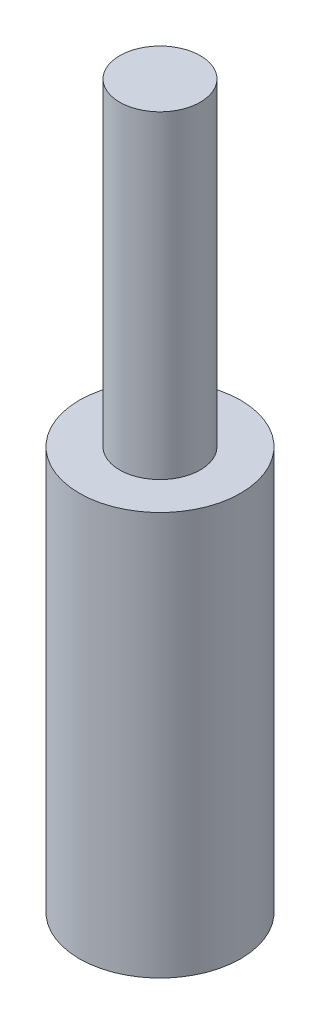
from build123d import *

# Parameters (mm, degrees)
SKETCH1_R           = 2
BOSS_EXTRUDE1_DEPTH = 10
SKETCH2_R           = 1
BOSS_EXTRUDE2_DEPTH = 7.9


with BuildPart() as part:
    # Sketch1 → Boss-Extrude1 (new body)
    with BuildSketch(Plane(origin=(0, 0, 0), x_dir=(1, 0, 0), z_dir=(0, 1, 0))):
        with Locations(Location((0, 0, 0), (0, 0, 270))):
            Circle(SKETCH1_R)
    extrude(amount=BOSS_EXTRUDE1_DEPTH)

    # Sketch2 → Boss-Extrude2 (add)
    with BuildSketch(Plane(origin=(0, 10, 0), x_dir=(1, 0, 0), z_dir=(0, 1, 0))):
        with Locations(Location((0, 0, 0), (0, 0, 270))):
            Circle(SKETCH2_R)
    extrude(amount=BOSS_EXTRUDE2_DEPTH)


solid = part.part
